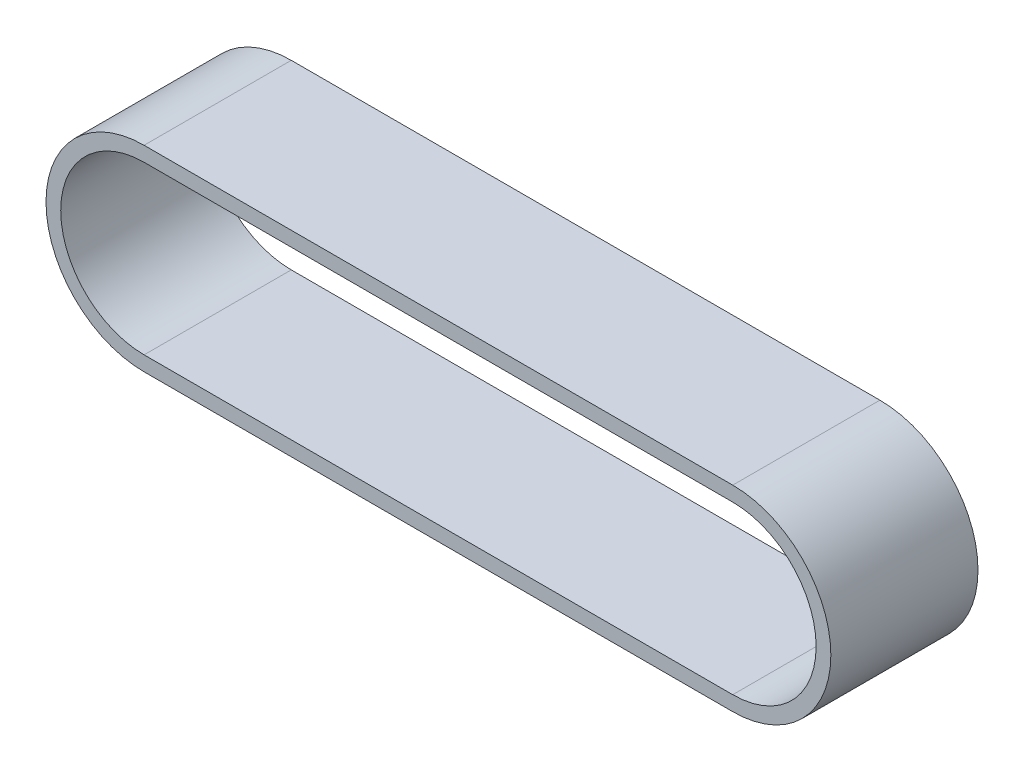
from build123d import *

# Parameters (mm, degrees)
BOSS_EXTRUDE1_DEPTH = 30


with BuildPart() as part:
    # Sketch1 → Boss-Extrude1 (new body)
    with BuildSketch(Plane.XY):
        with BuildLine():
            ThreePointArc((60, -20), (80, 0), (60, 20))
            Line((60, 20), (-60, 20))
            ThreePointArc((-60, 20), (-80, 0), (-60, -20))
            Line((-60, -20), (60, -20))
        make_face()
        with BuildLine():
            Line((-60, 17), (60, 17))
            ThreePointArc((60, 17), (77, 0), (60, -17))
            Line((60, -17), (-60, -17))
            ThreePointArc((-60, -17), (-77, 0), (-60, 17))
        make_face(mode=Mode.SUBTRACT)
    extrude(amount=BOSS_EXTRUDE1_DEPTH)


solid = part.part
